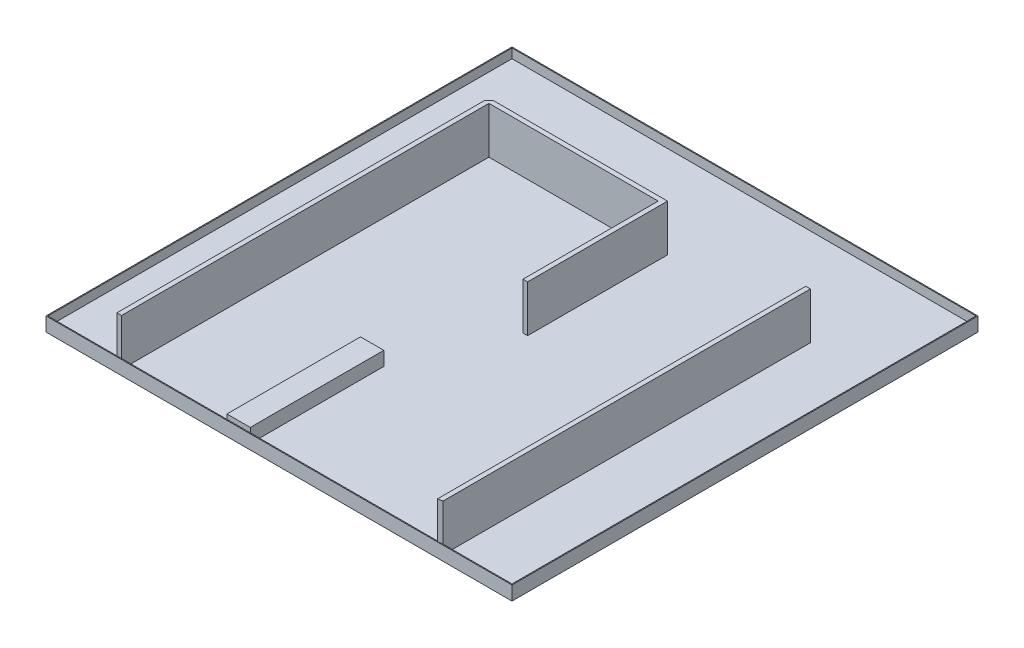
from build123d import *

# Parameters (mm, degrees)
SKETCH1_W           = 10000
SKETCH1_H           = 10000
BOSS_EXTRUDE1_DEPTH = 100
SKETCH2_W           = 10000
SKETCH2_H           = 10000
SKETCH2_W_2         = 9960
SKETCH2_H_2         = 9960
BOSS_EXTRUDE2_DEPTH = 200
BOSS_EXTRUDE3_DEPTH = 1000
SKETCH6_W           = 500
SKETCH6_H           = 2865.434079215
BOSS_EXTRUDE4_DEPTH = 300


with BuildPart() as part:
    # Sketch1 → Boss-Extrude1 (new body)
    with BuildSketch(Plane(origin=(0, 0, 0), x_dir=(1, 0, 0), z_dir=(0, 1, 0))):
        Rectangle(SKETCH1_W, SKETCH1_H)
    extrude(amount=BOSS_EXTRUDE1_DEPTH)

    # Sketch2 → Boss-Extrude2 (add)
    with BuildSketch(Plane(origin=(0, 100, 0), x_dir=(1, 0, 0), z_dir=(0, 1, 0))):
        Rectangle(SKETCH2_W, SKETCH2_H)
        Rectangle(SKETCH2_W_2, SKETCH2_H_2, mode=Mode.SUBTRACT)
    extrude(amount=BOSS_EXTRUDE2_DEPTH)

    # Sketch5 → Boss-Extrude3 (add)
    with BuildSketch(Plane(origin=(0, 100, 0), x_dir=(1, 0, 0), z_dir=(0, 1, 0))):
        Polygon((3500, -4980), (3500, 2903.048128535), (3400, 2903.048128535), (3400, -5000), align=None)
        Polygon((334.695730022, 3003.048128535), (-3397.936530428, 3003.048128535), (-3497.936530428, 2903.048128535), (-3497.936530428, -4980), (-3397.936530428, -4980), (-3397.936530428, 2903.048128535), (234.695730022, 2903.048128535), (234.695730022, 0), (334.695730022, 0), (334.695730022, 2903.048128535), align=None)
    extrude(amount=BOSS_EXTRUDE3_DEPTH)

    # Sketch6 → Boss-Extrude4 (add)
    with BuildSketch(Plane(origin=(0, 100, 0), x_dir=(1, 0, 0), z_dir=(0, 1, 0))):
        with Locations((-886.643182601, -3547.282960393)):
            Rectangle(SKETCH6_W, SKETCH6_H)
    extrude(amount=BOSS_EXTRUDE4_DEPTH)


solid = part.part
